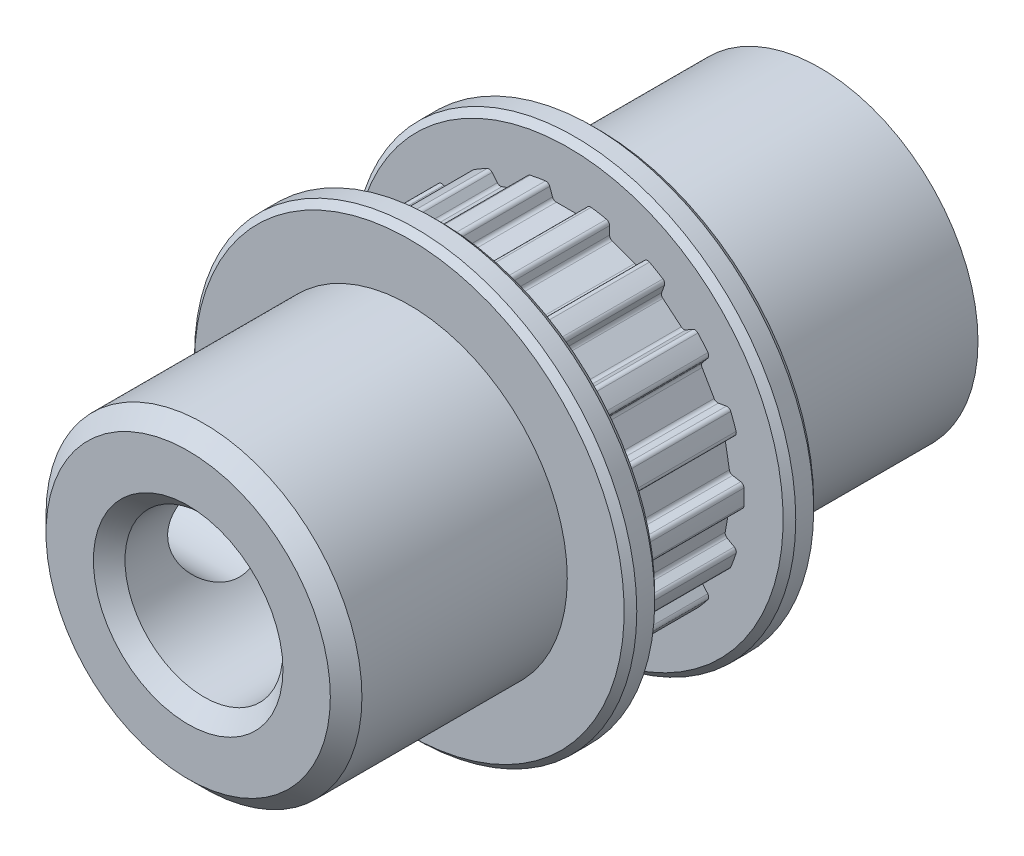
from build123d import *

# Parameters (mm, degrees)
TOOTH_EXTRUDE_START    = -2.032
TOOTH_EXTRUDE_DEPTH    = 4.064
TOOTH_PATTERN_18_COUNT = 18
SKETCH4_R              = 5
EXTRUDE_762_DEPTH      = 7
SKETCH6_R              = 1.65
CUT_EXTRUDE_916_DEPTH  = 5
BOSS_EXTRUDE3_START    = 8
SKETCH8_R              = 5
BOSS_EXTRUDE3_DEPTH    = 8
SKETCH5_R              = 2.5
CUT_EXTRUDE4_DEPTH     = 23
CHAMFER1_SIZE          = 0.5
CHAMFER2_SIZE          = 0.2
CHAMFER3_SIZE          = 1
CHAMFER3_SIZE2         = 1.732050808


with BuildPart() as part:
    # GearBelt-BaseSketch → 0.080in Pitch 'MXL', 0.125in Belt Width, 11,6425mm P.D. (revolve)
    with BuildSketch(Plane(origin=(0, 0, 0), x_dir=(0, 0, -1), z_dir=(1, 0, 0)), mode=Mode.PRIVATE) as f_0_080in_pitch_mxl_0_125in_belt_width_sk:
        Polygon((-3, 0), (3, 0), (3, 7), (2.032, 7), (2.032, 5.567251199), (-2.032, 5.567251199), (-2.032, 7), (-3, 7), align=None)
    revolve(f_0_080in_pitch_mxl_0_125in_belt_width_sk.sketch.rotate(Axis((0, 0, 3.048), (0, 0, -1)), 90), axis=Axis((0, 0, 3.048), (0, 0, -1)))

    # Tooth-Sketch → Tooth-Extrude (cut)
    with BuildSketch(Plane.XY.offset(TOOTH_EXTRUDE_START)):
        with BuildLine():
            Line((-0.379703626, 5.110051208), (0.379703626, 5.110051208))
            ThreePointArc((0.379703626, 5.110051208), (0.452547836, 5.133018899), (0.499044593, 5.193614652))
            Line((0.499044593, 5.193614652), (0.587822803, 5.43753078))
            ThreePointArc((0.587822803, 5.43753078), (0.641250062, 5.502650124), (0.723672162, 5.520016713))
            Line((0.723672162, 5.520016713), (0.723672162, 8.060016713))
            Line((0.723672162, 8.060016713), (-0.723672162, 8.060016713))
            Line((-0.723672162, 8.060016713), (-0.723672162, 5.520016713))
            ThreePointArc((-0.723672162, 5.520016713), (-0.641250062, 5.502650124), (-0.587822803, 5.43753078))
            Line((-0.587822803, 5.43753078), (-0.499044593, 5.193614652))
            ThreePointArc((-0.499044593, 5.193614652), (-0.452547836, 5.133018899), (-0.379703626, 5.110051208))
        make_face()
    tooth_extrude = extrude(amount=TOOTH_EXTRUDE_DEPTH, mode=Mode.SUBTRACT)

    # Tooth Pattern, 18: Tooth-Extrude ×18 about axis
    tooth_pattern_18_axis = Axis((0, 0, 0), (0, 0, 1))
    for i in range(1, TOOTH_PATTERN_18_COUNT):
        add(tooth_extrude.rotate(tooth_pattern_18_axis, i * 360 / TOOTH_PATTERN_18_COUNT), mode=Mode.SUBTRACT)

    # Sketch4 → Extrude 762 (add)
    with BuildSketch(Plane.XY.offset(3)):
        with Locations(Location((0, 0, 0), (0, 0, 180))):
            Circle(SKETCH4_R)
    extrude(amount=EXTRUDE_762_DEPTH)

    # Sketch6 → Cut-Extrude 916 (cut)
    with BuildSketch(Plane.ZY.offset(5)):
        with Locations((6.5, 0)):
            Circle(SKETCH6_R)
    extrude(amount=-CUT_EXTRUDE_916_DEPTH, mode=Mode.SUBTRACT)

    # Sketch8 → Boss-Extrude3 (add)
    with BuildSketch(Plane(origin=(0, 0, -3), x_dir=(-1, 0, 0), z_dir=(0, 0, -1)).offset(BOSS_EXTRUDE3_START)):
        Circle(SKETCH8_R)
    extrude(amount=-BOSS_EXTRUDE3_DEPTH)

    # Sketch5 → Cut-Extrude4 (cut)
    with BuildSketch(Plane.XY.offset(10)):
        Circle(SKETCH5_R)
    extrude(amount=-CUT_EXTRUDE4_DEPTH, mode=Mode.SUBTRACT)

    # Chamfer1
    chamfer1_edges = [part.edges().sort_by_distance(p)[0] for p in [
        (5, 0, 10),
        (-2.5, 0, 10),
    ]]
    chamfer(chamfer1_edges, length=CHAMFER1_SIZE)

    # Chamfer2
    chamfer2_edges = [part.edges().sort_by_distance(p)[0] for p in [
        (-7, 0, -3),
        (-7, 0, -2.032),
        (-7, 0, 2.032),
        (-7, 0, 3),
    ]]
    chamfer(chamfer2_edges, length=CHAMFER2_SIZE)

    # Chamfer3
    chamfer3_edges = [part.edges().sort_by_distance(p)[0] for p in [
        (5, 0, -11),
    ]]
    chamfer3_side = [part.faces().sort_by_distance(p)[0] for p in [
        (5, 0, -7),
    ]]
    chamfer(chamfer3_edges, length=CHAMFER3_SIZE, length2=CHAMFER3_SIZE2, reference=chamfer3_side[0])


solid = part.part
